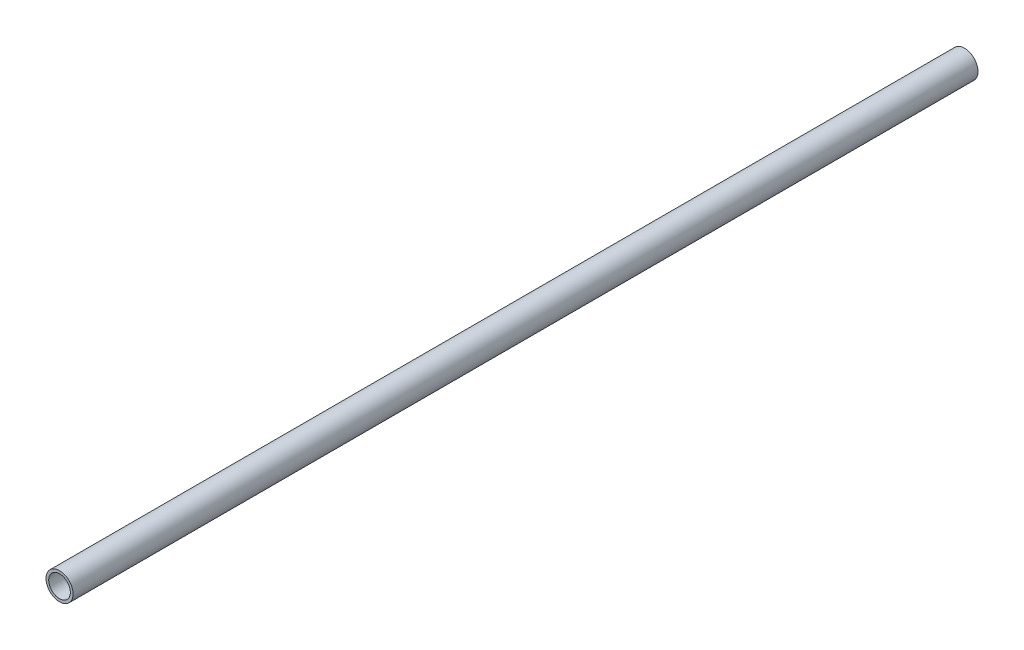
from build123d import *

# Parameters (mm, degrees)
EXTRUDE_1_DEPTH      = 30
EXTRUDE_1_DEPTH_BACK = 1040
SKETCH_1_R           = 16
SKETCH_1_R_2         = 12.8


with BuildPart() as part:
    # Эскиз1 → Бобышка-Вытянуть1 (new, two sides: drawn at the far end of the back side and taken through both)
    with BuildSketch(Plane.XY.offset(-EXTRUDE_1_DEPTH_BACK)):
        with Locations(Location((16, 16, 0), (0, 0, 180))):
            Circle(SKETCH_1_R)
        with Locations(Location((16, 16, 0), (0, 0, 180))):
            Circle(SKETCH_1_R_2, mode=Mode.SUBTRACT)
    extrude(amount=EXTRUDE_1_DEPTH + EXTRUDE_1_DEPTH_BACK)


solid = part.part
